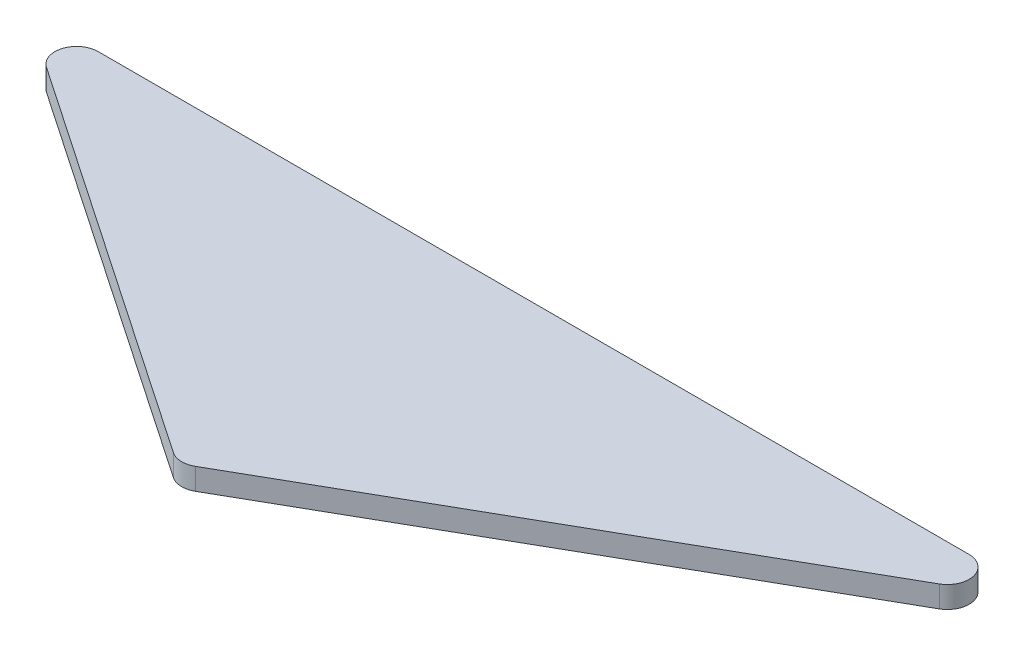
from build123d import *

# Parameters (mm, degrees)
BOSS_EXTRUDE1_DEPTH = 3.175
FILLET1_R           = 3.175
SKETCH2_R           = 0.712880647
BOSS_EXTRUDE2_DEPTH = 2.54


with BuildPart() as part:
    # Sketch1 → Boss-Extrude1 (new body)
    with BuildSketch(Plane(origin=(0, 0, 0), x_dir=(1, 0, 0), z_dir=(0, 1, 0))):
        Polygon((0, 0), (-68.386624181, 46.529866421), (81.613375819, 46.529866421), align=None)
    extrude(amount=BOSS_EXTRUDE1_DEPTH)

    # Fillet1
    fillet1_edges = [part.edges().sort_by_distance(p)[0] for p in [
        (0, 1.5875, 0),
        (-68.386624181, 1.5875, -46.529866421),
        (81.613375819, 1.5875, -46.529866421),
    ]]
    fillet(fillet1_edges, radius=FILLET1_R)

    # Sketch2 → Boss-Extrude2 (add)
    with BuildSketch(Plane(origin=(0, 3.175, 0), x_dir=(1, 0, 0), z_dir=(0, 1, 0))):
        with Locations((-58.076097719, 43.354866421)):
            Circle(SKETCH2_R)
    extrude(amount=-BOSS_EXTRUDE2_DEPTH)


solid = part.part
